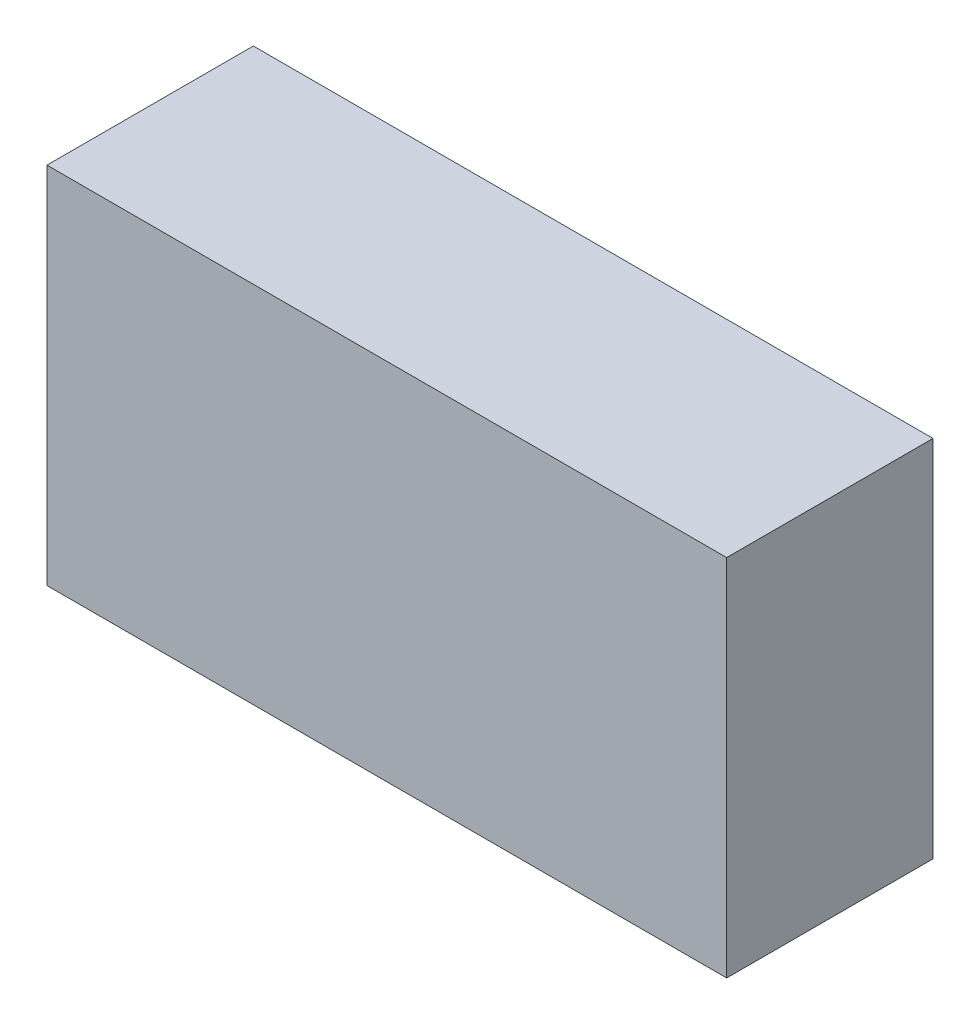
from build123d import *

# Parameters (mm, degrees)
SKIZZE1_W                       = 56
SKIZZE1_H                       = 30
AUFSATZ_LINEAR_AUSTRAGEN1_DEPTH = 17


with BuildPart() as part:
    # Skizze1 → Aufsatz-Linear austragen1 (new body)
    with BuildSketch(Plane.XY):
        with Locations((28, 15)):
            Rectangle(SKIZZE1_W, SKIZZE1_H)
    extrude(amount=AUFSATZ_LINEAR_AUSTRAGEN1_DEPTH)


solid = part.part
